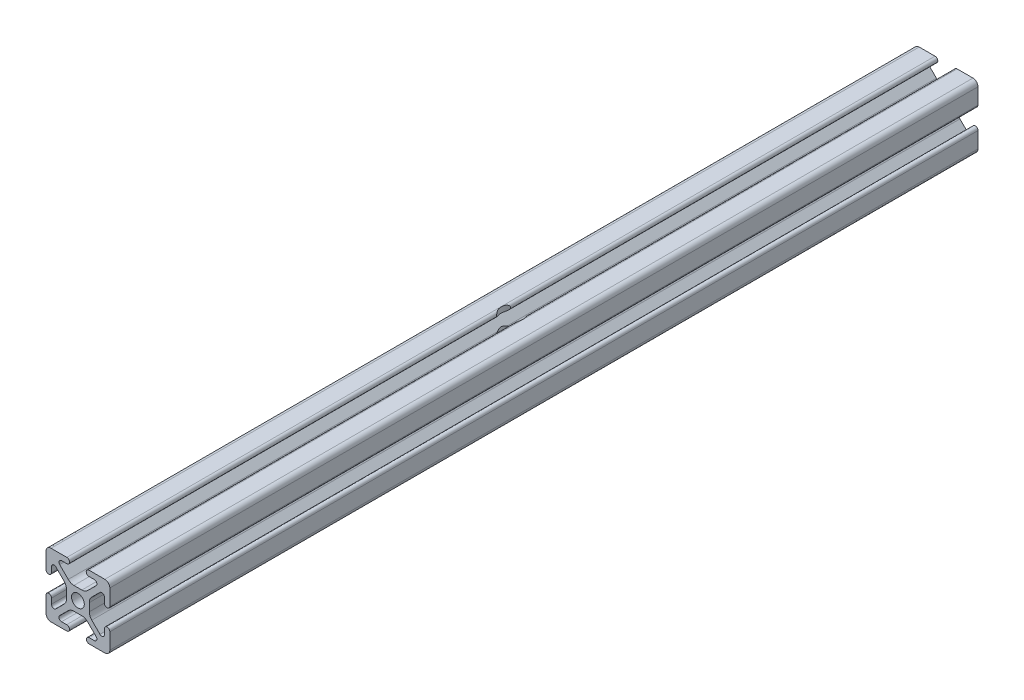
from build123d import *

# Parameters (mm, degrees)
SKETCH1_R               = 2.5
BOSS_EXTRUDE1_DEPTH     = 340
CUT_EXTRUDE1_DEPTH      = 501.312402405
CUT_EXTRUDE1_DEPTH_BACK = 501.312402405
SKETCH2_R               = 4.25


with BuildPart() as part:
    # Sketch1 → Boss-Extrude1 (new body)
    with BuildSketch(Plane(origin=(0, 0, -500), x_dir=(-1, 0, 0), z_dir=(0, 0, -1))):
        with BuildLine():
            Line((12.5, 4.32), (12.5, 10.537068835))
            ThreePointArc((12.5, 10.537068835), (11.925070773, 11.925070773), (10.537068835, 12.5))
            Line((10.537068835, 12.5), (4.32, 12.5))
            ThreePointArc((4.32, 12.5), (3.25, 11.43), (4.32, 10.36))
            Line((4.32, 10.36), (6.42, 10.36))
            ThreePointArc((6.42, 10.36), (7.35325999, 9.736168088), (7.133653912, 8.635298598))
            Line((7.133653912, 8.635298598), (3.795290766, 5.301828272))
            ThreePointArc((3.795290766, 5.301828272), (2.76743922, 4.61585726), (1.555406707, 4.375))
            Line((1.555406707, 4.375), (-1.555406707, 4.375))
            ThreePointArc((-1.555406707, 4.375), (-2.76743922, 4.61585726), (-3.795290766, 5.301828272))
            Line((-3.795290766, 5.301828272), (-7.133653912, 8.635298598))
            ThreePointArc((-7.133653912, 8.635298598), (-7.35325999, 9.736168088), (-6.42, 10.36))
            Line((-6.42, 10.36), (-4.32, 10.36))
            ThreePointArc((-4.32, 10.36), (-3.25, 11.43), (-4.32, 12.5))
            Line((-4.32, 12.5), (-10.537068835, 12.5))
            ThreePointArc((-10.537068835, 12.5), (-11.925070773, 11.925070773), (-12.5, 10.537068835))
            Line((-12.5, 10.537068835), (-12.5, 4.32))
            ThreePointArc((-12.5, 4.32), (-11.43, 3.25), (-10.36, 4.32))
            Line((-10.36, 4.32), (-10.36, 6.396886949))
            ThreePointArc((-10.36, 6.396886949), (-9.736852394, 7.329863489), (-8.636346088, 7.111588351))
            Line((-8.636346088, 7.111588351), (-5.432204773, 3.912143135))
            ThreePointArc((-5.432204773, 3.912143135), (-4.708985779, 2.831057106), (-4.455, 1.555406707))
            Line((-4.455, 1.555406707), (-4.455, -1.555406707))
            ThreePointArc((-4.455, -1.555406707), (-4.708985779, -2.831057106), (-5.432204773, -3.912143135))
            Line((-5.432204773, -3.912143135), (-8.636346088, -7.111588351))
            ThreePointArc((-8.636346088, -7.111588351), (-9.736852394, -7.329863489), (-10.36, -6.396886949))
            Line((-10.36, -6.396886949), (-10.36, -4.32))
            ThreePointArc((-10.36, -4.32), (-11.43, -3.25), (-12.5, -4.32))
            Line((-12.5, -4.32), (-12.5, -10.537068835))
            ThreePointArc((-12.5, -10.537068835), (-11.925070773, -11.925070773), (-10.537068835, -12.5))
            Line((-10.537068835, -12.5), (-4.387856959, -12.5))
            ThreePointArc((-4.387856959, -12.5), (-3.317856959, -11.43), (-4.387856959, -10.36))
            Line((-4.387856959, -10.36), (-6.42, -10.36))
            ThreePointArc((-6.42, -10.36), (-7.35325999, -9.736168088), (-7.133653912, -8.635298598))
            Line((-7.133653912, -8.635298598), (-3.795290766, -5.301828272))
            ThreePointArc((-3.795290766, -5.301828272), (-2.76743922, -4.61585726), (-1.555406707, -4.375))
            Line((-1.555406707, -4.375), (1.555406707, -4.375))
            ThreePointArc((1.555406707, -4.375), (2.76743922, -4.61585726), (3.795290766, -5.301828272))
            Line((3.795290766, -5.301828272), (7.133653912, -8.635298598))
            ThreePointArc((7.133653912, -8.635298598), (7.35325999, -9.736168088), (6.42, -10.36))
            Line((6.42, -10.36), (4.387856959, -10.36))
            ThreePointArc((4.387856959, -10.36), (3.317856959, -11.43), (4.387856959, -12.5))
            Line((4.387856959, -12.5), (10.537068835, -12.5))
            ThreePointArc((10.537068835, -12.5), (11.925070773, -11.925070773), (12.5, -10.537068835))
            Line((12.5, -10.537068835), (12.5, -4.32))
            ThreePointArc((12.5, -4.32), (11.43, -3.25), (10.36, -4.32))
            Line((10.36, -4.32), (10.36, -6.396886949))
            ThreePointArc((10.36, -6.396886949), (9.736852394, -7.329863489), (8.636346088, -7.111588351))
            Line((8.636346088, -7.111588351), (5.432204773, -3.912143135))
            ThreePointArc((5.432204773, -3.912143135), (4.708985779, -2.831057106), (4.455, -1.555406707))
            Line((4.455, -1.555406707), (4.455, 1.555406707))
            ThreePointArc((4.455, 1.555406707), (4.708985779, 2.831057106), (5.432204773, 3.912143135))
            Line((5.432204773, 3.912143135), (8.636346088, 7.111588351))
            ThreePointArc((8.636346088, 7.111588351), (9.736852394, 7.329863489), (10.36, 6.396886949))
            Line((10.36, 6.396886949), (10.36, 4.32))
            ThreePointArc((10.36, 4.32), (11.43, 3.25), (12.5, 4.32))
        make_face()
        with Locations(Location((0, 0, 0), (0, 0, 180))):
            Circle(SKETCH1_R, mode=Mode.SUBTRACT)
    extrude(amount=-BOSS_EXTRUDE1_DEPTH)

    # Sketch2 → Cut-Extrude1 (cut, two sides: drawn at the far end of the back side and taken through both)
    with BuildSketch(Plane(origin=(0, 0, 0), x_dir=(1, 0, 0), z_dir=(0, 1, 0)).offset(-CUT_EXTRUDE1_DEPTH_BACK)):
        with Locations(Location((0, 330, 0), (0, 0, 248.532214104))):
            Circle(SKETCH2_R)
    extrude(amount=CUT_EXTRUDE1_DEPTH + CUT_EXTRUDE1_DEPTH_BACK, mode=Mode.SUBTRACT)


solid = part.part
